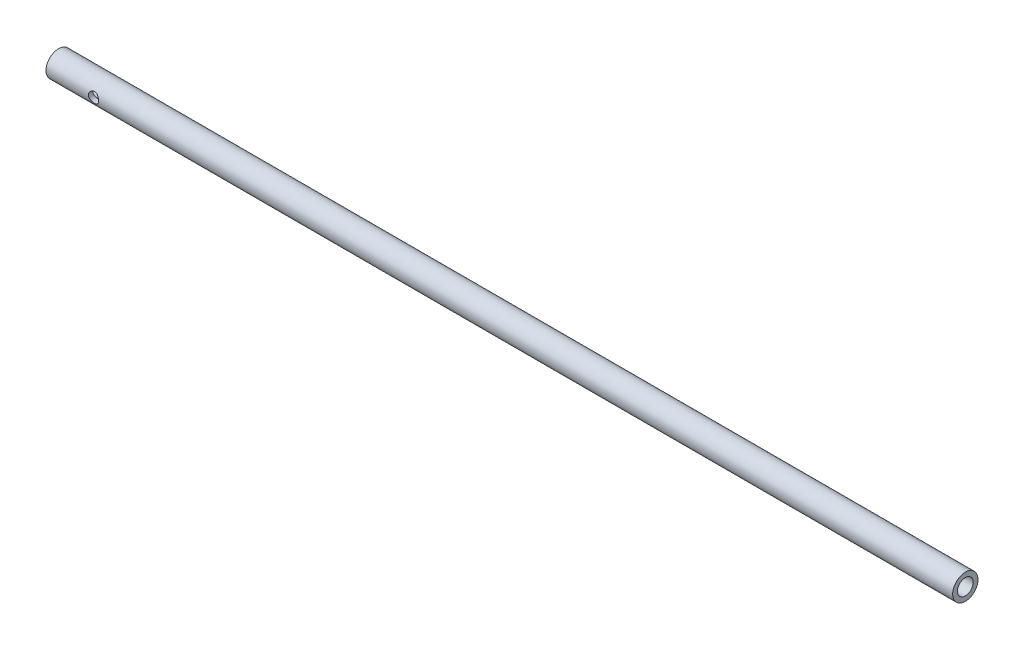
from build123d import *

# Parameters (mm, degrees)
BOSS_EXTRUDE1_DEPTH      = 226
BOSS_EXTRUDE1_DEPTH_BACK = 920
SKETCH1_R                = 16
SKETCH1_R_2              = 10
SKETCH2_R                = 6.5
CUT_EXTRUDE1_DEPTH       = 29.5


with BuildPart() as part:
    # Sketch1 → Boss-Extrude1 (new, two sides: drawn at the far end of the back side and taken through both)
    with BuildSketch(Plane(origin=(0, 0, 0), x_dir=(0, 0, -1), z_dir=(1, 0, 0)).offset(-BOSS_EXTRUDE1_DEPTH_BACK)):
        with Locations(Location((0, 0, 0), (0, 0, 180))):
            Circle(SKETCH1_R)
        with Locations(Location((0, 0, 0), (0, 0, 180))):
            Circle(SKETCH1_R_2, mode=Mode.SUBTRACT)
    extrude(amount=BOSS_EXTRUDE1_DEPTH + BOSS_EXTRUDE1_DEPTH_BACK)

    # Sketch2 → Cut-Extrude1 (cut, symmetric)
    with BuildSketch(Plane.XY):
        with Locations((-860, 0)):
            Circle(SKETCH2_R)
    extrude(amount=CUT_EXTRUDE1_DEPTH, both=True, mode=Mode.SUBTRACT)


solid = part.part
